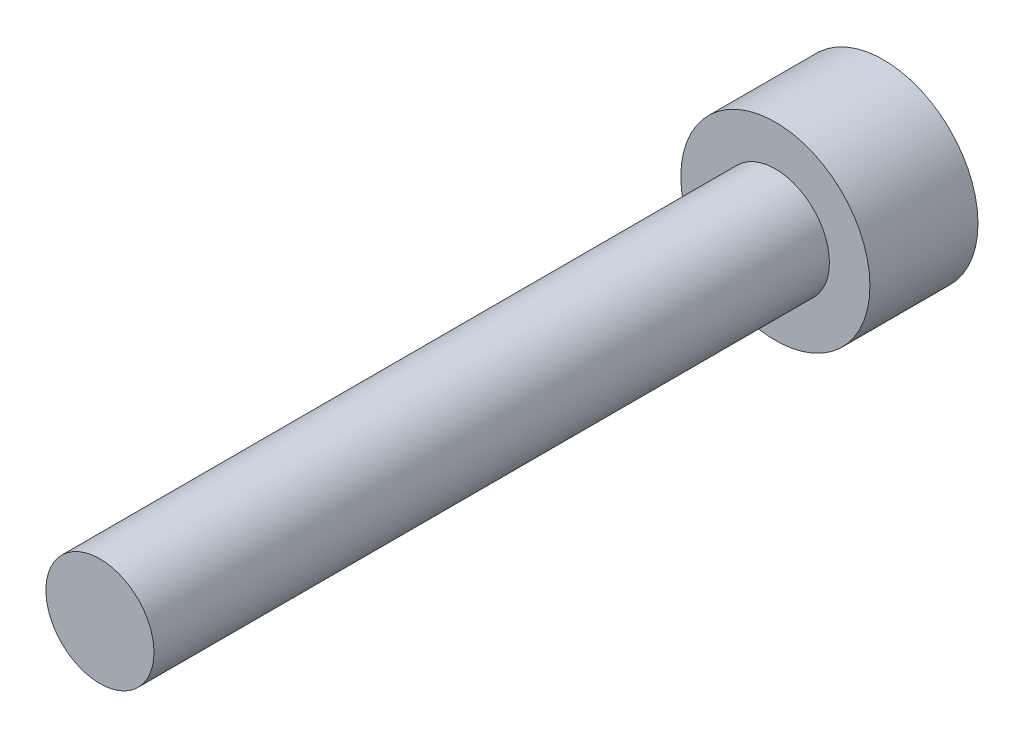
from build123d import *

# Parameters (mm, degrees)
SKETCH_1_R        = 2
EXTRUDE_246_DEPTH = 25
EXTRUDE_START     = -4
SKETCH_2_R        = 3.5
EXTRUDE_315_DEPTH = 4


with BuildPart() as part:
    # 草图1 → Extrude 246 (new body)
    with BuildSketch(Plane.XY):
        Circle(SKETCH_1_R)
    extrude(amount=EXTRUDE_246_DEPTH)

    # 草图2 → Extrude 315 (add)
    with BuildSketch(Plane.XY.offset(EXTRUDE_START)):
        Circle(SKETCH_2_R)
    extrude(amount=EXTRUDE_315_DEPTH)


solid = part.part
